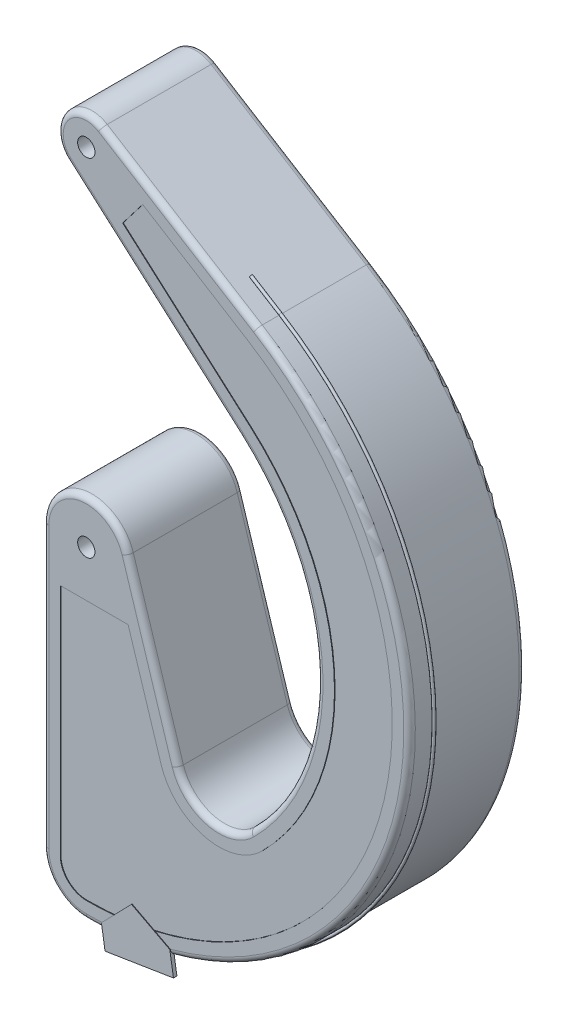
from build123d import *

# Parameters (mm, degrees)
ESQUISSE1_R             = 1.5
BOSS_EXTRU_1_DEPTH      = 10
CONG_1_R                = 1
BOSS_EXTRU_2_DEPTH      = 0.1
BOSS_EXTRU_2_DEPTH_BACK = 0.5
ENL_V_MAT_EXTRU_2_DEPTH = 0.1
ESQUISSE5_W             = 12
ESQUISSE5_H             = 38
ENL_V_MAT_EXTRU_3_DEPTH = 10
ESQUISSE6_R             = 1
BOSS_EXTRU_3_DEPTH      = 12
ESQUISSE9_R             = 0.25
ESQUISSE11_R            = 0.25


with BuildPart() as part:
    # Esquisse1 → Boss.-Extru.1 (new, symmetric)
    with BuildSketch(Plane.XY):
        with BuildLine():
            Line((-7.5, 0), (-7.5, -48.5))
            ThreePointArc((-7.5, -48.5), (-5.303300859, -53.803300859), (0, -56))
            ThreePointArc((0, -56), (53.859075373, -15.33623161), (29.499830508, 47.6))
            Line((29.499830508, 47.6), (2.633913438, 64.25))
            ThreePointArc((2.633913438, 64.25), (-4.014140636, 62.981052659), (-3.307189139, 56.25))
            Line((-3.307189139, 56.25), (26.457513111, 30))
            ThreePointArc((26.457513111, 30), (39.980367775, 1.253073266), (28.284271247, -28.284271247))
            ThreePointArc((28.284271247, -28.284271247), (21.199189149, -30.266247021), (15.828627753, -25.237958386))
            Line((15.828627753, -25.237958386), (7.152342636, 2.256987997))
            ThreePointArc((7.152342636, 2.256987997), (-1.141803449, 7.41257613), (-7.5, 0))
        make_face()
        with Locations((0, 60)):
            Circle(ESQUISSE1_R, mode=Mode.SUBTRACT)
        Circle(ESQUISSE1_R, mode=Mode.SUBTRACT)
    extrude(amount=BOSS_EXTRU_1_DEPTH, both=True)

    # Congé1
    cong_1_edges = [part.edges().sort_by_distance(p)[0] for p in [
        (-4.014140636, 62.981052659, 10),
        (-1.141803449, 7.41257613, -10),
        (11.490485194, -11.490485194, -10),
        (21.199189149, -30.266247021, -10),
        (39.980367775, 1.253073266, -10),
        (11.575161986, 43.125, -10),
        (-4.014140636, 62.981052659, -10),
        (16.066871973, 55.925, -10),
        (53.859075373, -15.33623161, -10),
        (11.575161986, 43.125, 10),
        (39.980367775, 1.253073266, 10),
        (21.199189149, -30.266247021, 10),
        (11.490485194, -11.490485194, 10),
        (-1.141803449, 7.41257613, 10),
        (-7.5, -24.25, 10),
        (-5.303300859, -53.803300859, 10),
        (53.859075373, -15.33623161, 10),
        (16.066871973, 55.925, 10),
        (-5.303300859, -53.803300859, -10),
        (-7.5, -24.25, -10),
    ]]
    fillet(cong_1_edges, radius=CONG_1_R)

    # Esquisse2 → Boss.-Extru.2 (add, two sides: drawn at the far end of the back side and taken through both)
    with BuildSketch(Plane.XY.offset(10).offset(-BOSS_EXTRU_2_DEPTH_BACK)):
        Polygon((14.56616208, -53.036090752), (15.198414635, -56.985806781), (3.349266549, -58.882564443), (2.717013994, -54.932848415), (7.933336842, -49.559985919), align=None)
    extrude(amount=BOSS_EXTRU_2_DEPTH + BOSS_EXTRU_2_DEPTH_BACK)

    # Esquisse4 → Enlèv. mat.-Extru.2 (cut)
    with BuildSketch(Plane(origin=(0, 0, -10), x_dir=(-1, 0, 0), z_dir=(0, 0, -1))):
        with BuildLine():
            Line((-7.243207801, -8), (4.5, -8))
            Line((4.5, -8), (4.5, -48.5))
            ThreePointArc((4.5, -48.5), (3.181980515, -51.681980515), (0, -53))
            ThreePointArc((0, -53), (-50.973767763, -14.514647774), (-27.919482445, 45.05))
            Line((-27.919482445, 45.05), (-9.762493273, 56.302691242))
            Line((-9.762493273, 56.302691242), (-6.299907598, 51.777337071))
            Line((-6.299907598, 51.777337071), (-28.441826594, 32.25))
            ThreePointArc((-28.441826594, 32.25), (-42.978895358, 1.347053761), (-30.405591591, -30.405591591))
            ThreePointArc((-30.405591591, -30.405591591), (-20.486476653, -33.180357674), (-12.967690698, -26.140753584))
            Line((-12.967690698, -26.140753584), (-7.243207801, -8))
        make_face()
    enl_v_mat_extru_2 = extrude(amount=-ENL_V_MAT_EXTRU_2_DEPTH, mode=Mode.SUBTRACT)

    # Symétrie1: Enlèv. mat.-Extru.2 across plane
    add(enl_v_mat_extru_2.mirror(Plane.XY), mode=Mode.SUBTRACT)

    # Esquisse5 → Enlèv. mat.-Extru.3 (cut)
    with BuildSketch(Plane.ZY.offset(7.5)):
        with Locations((0, -24.5)):
            Rectangle(ESQUISSE5_W, ESQUISSE5_H)
    extrude(amount=-ENL_V_MAT_EXTRU_3_DEPTH, mode=Mode.SUBTRACT)

    # Esquisse6 → Boss.-Extru.3 (add)
    with BuildSketch(Plane.XY.offset(-6)):
        with Locations(Location((-3.5, -39.5, 0), (0, 0, 180))):
            Circle(ESQUISSE6_R)
    extrude(amount=BOSS_EXTRU_3_DEPTH)

    # Balayage1: sweep along a path in Esquisse7
    with BuildLine(Plane.ZY.offset(4)) as balayage1_path:
        ThreePointArc((0, -19.140027412), (-0.51763809, -19.071879064), (-1, -18.872078219))
        Line((-1, -18.872078219), (-7.476454329, -15.132895569))
    # Esquisse9 → Balayage1 (sweep)
    with BuildSketch(Plane.XY):
        with Locations((-4, -19.140027412)):
            Circle(ESQUISSE9_R)
    balayage1 = sweep(path=balayage1_path.line)

    # Symétrie2: Balayage1 across Front Plane
    add(balayage1.mirror(Plane.XY))


with BuildPart() as body_2:
    # Balayage3: sweep along a path in Esquisse10
    with BuildLine(Plane(origin=(0, 0, 6), x_dir=(-1, 0, 0), z_dir=(0, 0, -1))) as balayage3_path:
        Line((7.75, -43.5), (7.75, -48.5))
        ThreePointArc((7.75, -48.5), (5.480077554, -53.980077554), (0, -56.25))
        ThreePointArc((0, -56.25), (-54.099517673, -15.40469693), (-29.63152618, 47.8125))
        Line((-29.63152618, 47.8125), (-24.53152618, 50.973196126))
    # Esquisse11 → Balayage3 (sweep)
    with BuildSketch(Plane(origin=(0, -43.5, 0), x_dir=(1, 0, 0), z_dir=(0, 1, 0))):
        with Locations((-7.75, -6)):
            Circle(ESQUISSE11_R)
    sweep(path=balayage3_path.line)


solid = Compound([part.part, body_2.part])
